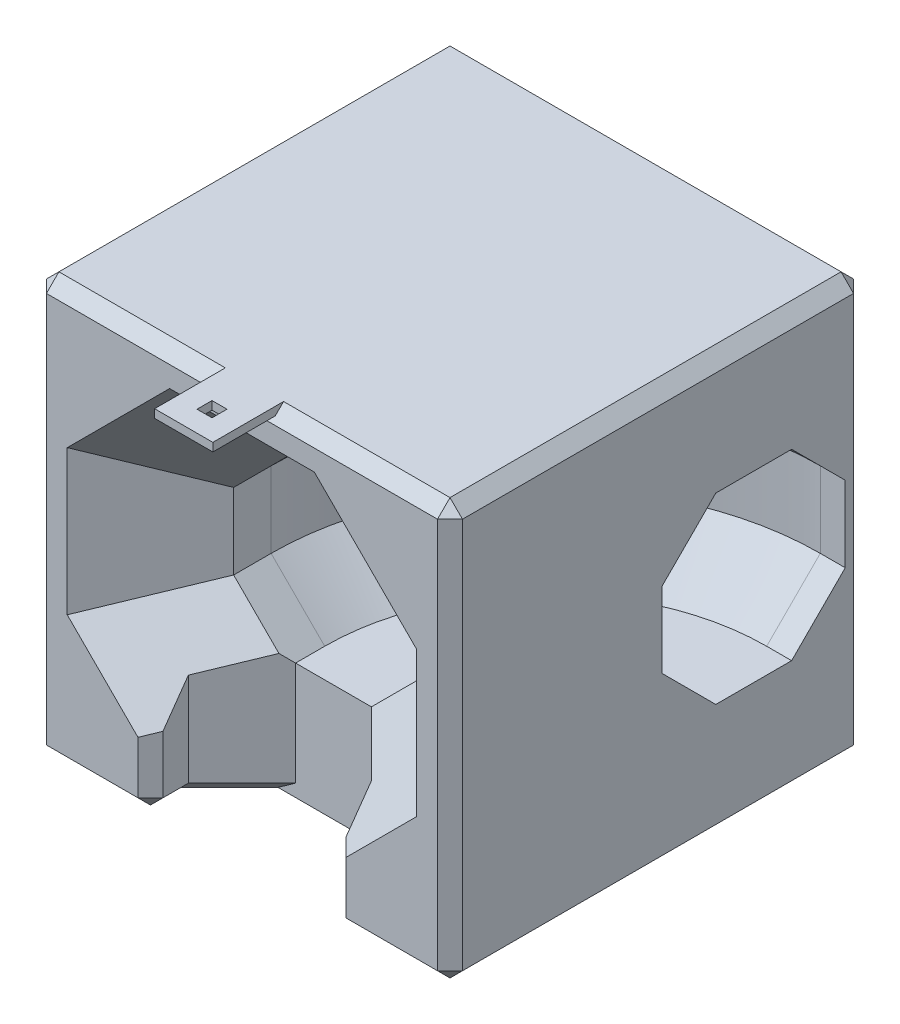
from build123d import *

# Parameters (mm, degrees)
SKETCH1_W                = 50
SKETCH1_H                = 50
BOSS_EXTRUDE1_DEPTH      = 50
CHAMFER1_SIZE            = 10
CUT_EXTRUDE1_DEPTH       = 22
CHAMFER2_SIZE            = 1.5
BOSS_EXTRUDE2_DEPTH      = 7
BOSS_EXTRUDE2_DEPTH_BACK = 10
SKETCH11_W               = 7
SKETCH11_H               = 1
SKETCH12_W               = 1.8
SKETCH12_H               = 1.8
CUT_EXTRUDE2_DEPTH       = 7


with BuildPart() as part:
    # Sketch1 → Boss-Extrude1 (new body)
    with BuildSketch(Plane.XY):
        with Locations((25, 25)):
            Rectangle(SKETCH1_W, SKETCH1_H)
    extrude(amount=BOSS_EXTRUDE1_DEPTH)

    # Cut-Sweep5: sweep along a path in Sketch9
    with BuildLine(Plane(origin=(0, 25, 0), x_dir=(-1, 0, 0), z_dir=(0, -1, 0))) as cut_sweep5_path:
        Line((-50, -13.5), (-47, -13.5))
        ThreePointArc((-47, -13.5), (-31.443650814, -19.943650814), (-25, -35.5))
        Line((-25, -35.5), (-25, -50))
    # Sketch8 → Cut-Sweep5 (sweep, cut)
    with BuildSketch(Plane(origin=(50, 0, 0), x_dir=(0, 0, -1), z_dir=(1, 0, 0))):
        Polygon((-2.5, 29.556349186), (-8.943650814, 36), (-18.056349186, 36), (-24.5, 29.556349186), (-24.5, 20.443650814), (-18.056349186, 14), (-8.943650814, 14), (-2.5, 20.443650814), align=None)
    sweep(path=cut_sweep5_path.line, mode=Mode.SUBTRACT)

    # Chamfer1
    chamfer1_edges = [part.edges().sort_by_distance(p)[0] for p in [
        (17.221825407, 17.221825407, 50),
        (32.778174593, 17.221825407, 50),
        (36, 25, 50),
        (32.778174593, 32.778174593, 50),
        (17.221825407, 32.778174593, 50),
        (14, 25, 50),
        (25, 14, 50),
        (25, 36, 50),
    ]]
    chamfer(chamfer1_edges, length=CHAMFER1_SIZE)

    # Sketch10 → Cut-Extrude1 (cut)
    with BuildSketch(Plane.XZ):
        Polygon((29.556349186, 39), (36, 45.443650814), (36, 54.556349186), (29.556349186, 61), (20.443650814, 61), (14, 54.556349186), (14, 45.443650814), (20.443650814, 39), align=None)
    extrude(amount=-CUT_EXTRUDE1_DEPTH, mode=Mode.SUBTRACT)

    # Chamfer2
    chamfer2_edges = [part.edges().sort_by_distance(p)[0] for p in [
        (50, 25, 50),
        (25, 50, 50),
        (0, 25, 50),
        (25, 50, 0),
        (50, 25, 0),
        (25, 0, 0),
        (0, 25, 0),
        (7, 0, 50),
        (0, 50, 25),
        (50, 50, 25),
        (50, 0, 25),
        (0, 0, 25),
        (43, 0, 50),
        (36, 0, 47.721825407),
        (14, 0, 47.721825407),
        (17.221825407, 0, 42.221825407),
        (32.778174593, 0, 42.221825407),
        (14, 3.150757595, 50),
        (36, 3.150757595, 50),
    ]]
    chamfer(chamfer2_edges, length=CHAMFER2_SIZE)

    # Sketch11 → Boss-Extrude2 (add, two sides: drawn at the far end of the back side and taken through both)
    with BuildSketch(Plane.XY.offset(50).offset(-BOSS_EXTRUDE2_DEPTH_BACK)):
        with Locations((25, 49.5)):
            Rectangle(SKETCH11_W, SKETCH11_H)
    extrude(amount=BOSS_EXTRUDE2_DEPTH + BOSS_EXTRUDE2_DEPTH_BACK)

    # Sketch12 → Cut-Extrude2 (cut)
    with BuildSketch(Plane.XZ.offset(-49)):
        with Locations((25, 53.6)):
            Rectangle(SKETCH12_W, SKETCH12_H)
    extrude(amount=-CUT_EXTRUDE2_DEPTH, mode=Mode.SUBTRACT)


solid = part.part
